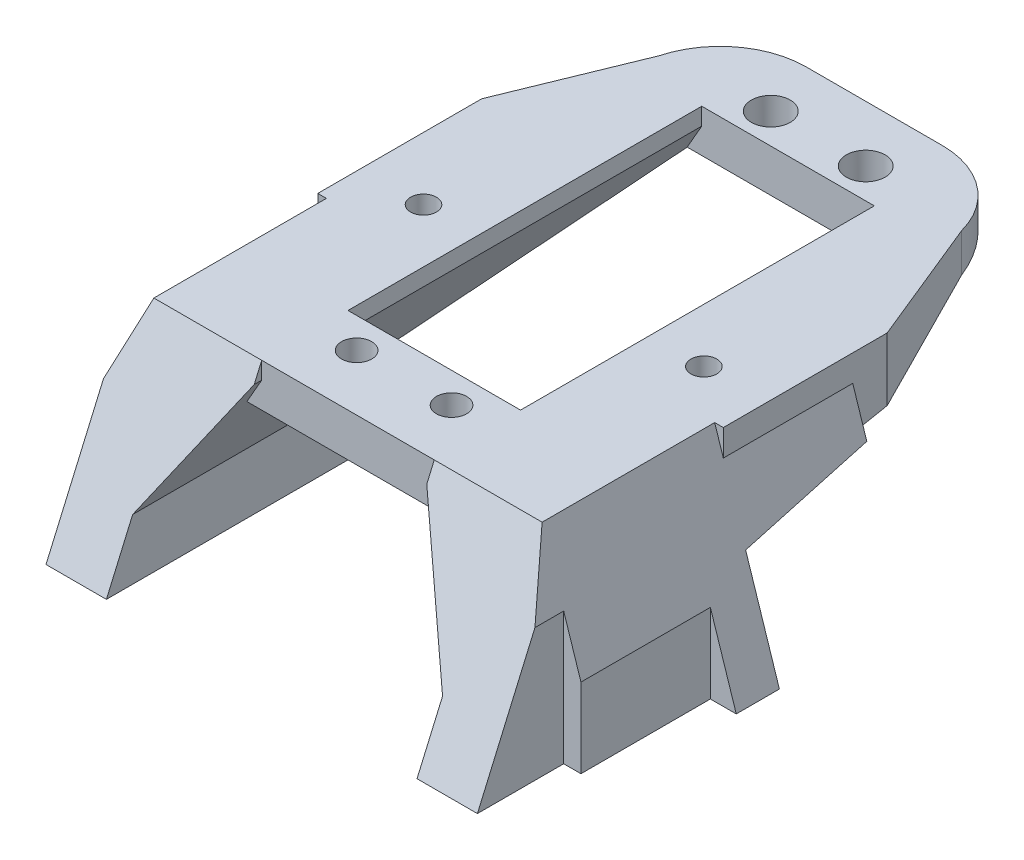
from build123d import *

# Parameters (mm, degrees)
SALIENTE_EXTRUIR1_DEPTH = 35
CROQUIS6_R              = 2.25
CROQUIS6_W              = 20
CROQUIS6_H              = 25
CORTAR_EXTRUIR3_DEPTH   = 10
CROQUIS7_R              = 2.25
SALIENTE_EXTRUIR4_DEPTH = 15
CROQUIS8_R              = 1.5
CORTAR_EXTRUIR4_DEPTH   = 10
CORTAR_EXTRUIR8_DEPTH   = 50
CORTAR_EXTRUIR11_REACH  = 69.158
CORTAR_EXTRUIR12_DEPTH  = 16
CROQUIS13_W             = 6.081292266
CROQUIS13_H             = 9.753773429
CORTAR_EXTRUIR13_DEPTH  = 15
CORTAR_EXTRUIR14_DEPTH  = 63.5
CORTAR_EXTRUIR15_DEPTH  = 100
SALIENTE_EXTRUIR5_REACH = 69.158
CROQUIS16_W             = 15
CROQUIS16_H             = 10
CORTAR_EXTRUIR16_DEPTH  = 200
CORTAR_EXTRUIR17_DEPTH  = 200
SALIENTE_EXTRUIR7_DEPTH = 23.5
CROQUIS22_R             = 2.25
CORTAR_EXTRUIR19_DEPTH  = 47
CORTAR_EXTRUIR20_DEPTH  = 31
CROQUIS24_W             = 29.420485752
CROQUIS24_H             = 5
SALIENTE_EXTRUIR9_DEPTH = 10
CROQUIS25_R             = 1.75
CROQUIS25_R_2           = 1.5
CORTAR_EXTRUIR21_DEPTH  = 5


with BuildPart() as part:
    # Croquis1 → Saliente-Extruir1 (new body)
    with BuildSketch(Plane.XY):
        Polygon((0, 0), (45, 0), (52.5, -23), (40.5, -23), (40.5, -16.192411456), (32.5, -2), (12.5, -2), (4.5, -16), (4.5, -23), (-7.5, -23), align=None)
    extrude(amount=SALIENTE_EXTRUIR1_DEPTH)

    # Croquis6 → Cortar-Extruir3 (cut)
    with BuildSketch(Plane(origin=(0, 0, 0), x_dir=(1, 0, 0), z_dir=(0, 1, 0))):
        with Locations(Location((17, -28.5, 0), (0, 0, 180))):
            Circle(CROQUIS6_R)
        with Locations(Location((28, -28.5, 0), (0, 0, 270))):
            Circle(CROQUIS6_R)
        with Locations((22.5, -12.5)):
            Rectangle(CROQUIS6_W, CROQUIS6_H)
    extrude(amount=-CORTAR_EXTRUIR3_DEPTH, mode=Mode.SUBTRACT)

    # Croquis8 → Cortar-Extruir4 (cut)
    with BuildSketch(Plane(origin=(0, -23, 0), x_dir=(-1, 0, 0), z_dir=(0, -1, 0))):
        with Locations(Location((-2.5, -33.3, 0), (0, 0, 90))):
            Circle(CROQUIS8_R)
        with Locations(Location((-42.5, -33.3, 0), (0, 0, 270))):
            Circle(CROQUIS8_R)
    extrude(amount=-CORTAR_EXTRUIR4_DEPTH, mode=Mode.SUBTRACT)

    # Cortar-Extruir11: up to this plane
    cortar_extruir11_end = Plane(origin=(50, -15, 0), z_dir=(0, -0.9079593845004518, -0.41905817746174695))
    # Croquis11 → Cortar-Extruir11 (cut, up to the surface)
    with BuildSketch(Plane.XZ.offset(23), mode=Mode.PRIVATE) as cortar_extruir11_sk1:
        with BuildLine():
            Line((-7.5, 15), (-7.5, -3.030649644))
            Line((-7.5, -3.030649644), (52.5, -3.030649644))
            Line((52.5, -3.030649644), (52.5, 15))
            ThreePointArc((52.5, 15), (22.5, 5.553378231), (-7.5, 15))
        make_face()
    cortar_extruir11_tool1 = split(extrude(cortar_extruir11_sk1.sketch, amount=-CORTAR_EXTRUIR11_REACH, mode=Mode.PRIVATE), bisect_by=cortar_extruir11_end, keep=Keep.BOTH, mode=Mode.PRIVATE)
    add(cortar_extruir11_tool1.solids().sort_by_distance((22.5, -23, 3.105508))[0], mode=Mode.SUBTRACT)

    # Croquis13 → Cortar-Extruir13 (cut)
    with BuildSketch(Plane.XY.offset(35)):
        with Locations((-7.540646133, -18.123113286)):
            Rectangle(CROQUIS13_W, CROQUIS13_H)
        with Locations((52.540646133, -18.123113286)):
            Rectangle(CROQUIS13_W, CROQUIS13_H)
    extrude(amount=-CORTAR_EXTRUIR13_DEPTH, mode=Mode.SUBTRACT)

    # Croquis14 → Cortar-Extruir14 (cut, symmetric)
    with BuildSketch(Plane(origin=(0, 0, 0), x_dir=(0, 0, -1), z_dir=(1, 0, 0))):
        Polygon((-15, -11), (-15, -28.858785619), (26, -23), (26, -3), align=None)
    extrude(amount=CORTAR_EXTRUIR14_DEPTH, both=True, mode=Mode.SUBTRACT)

    # Saliente-Extruir5: up to this face of the body (flat: up to its plane)
    saliente_extruir5_end = Plane(part.part.faces().sort_by_distance((6.25, 0, 0.570087713))[0])
    # Croquis16 → Saliente-Extruir5 (add, up to the picked face)
    with BuildSketch(Plane.XZ.offset(23), mode=Mode.PRIVATE) as saliente_extruir5_sk1:
        with Locations((5, 40)):
            Rectangle(CROQUIS16_W, CROQUIS16_H)
    saliente_extruir5_tool1 = split(extrude(saliente_extruir5_sk1.sketch, amount=-SALIENTE_EXTRUIR5_REACH, mode=Mode.PRIVATE), bisect_by=saliente_extruir5_end, keep=Keep.BOTH, mode=Mode.PRIVATE)
    # Croquis16 → Saliente-Extruir5 (add, up to the picked face)
    with BuildSketch(Plane.XZ.offset(23), mode=Mode.PRIVATE) as saliente_extruir5_sk2:
        with Locations((40, 40)):
            Rectangle(CROQUIS16_W, CROQUIS16_H)
    saliente_extruir5_tool2 = split(extrude(saliente_extruir5_sk2.sketch, amount=-SALIENTE_EXTRUIR5_REACH, mode=Mode.PRIVATE), bisect_by=saliente_extruir5_end, keep=Keep.BOTH, mode=Mode.PRIVATE)
    add(saliente_extruir5_tool1.solids().sort_by(Axis((5, -23, 40), (0, 1, 0)))[0])
    add(saliente_extruir5_tool2.solids().sort_by(Axis((40, -23, 40), (0, 1, 0)))[0])

    # Croquis17 → Cortar-Extruir16 (cut)
    with BuildSketch(Plane.ZY.offset(2.5)):
        Polygon((35, 0), (45, -23), (45, 0), align=None)
    extrude(amount=-CORTAR_EXTRUIR16_DEPTH, mode=Mode.SUBTRACT)

    # Croquis18 → Cortar-Extruir17 (cut)
    with BuildSketch(Plane(origin=(0, 0, 35), x_dir=(-1, 0, 0), z_dir=(0, 0, -1))):
        Polygon((-32.5, -2), (-40.5, -16.192411456), (-40.5, -23), (-32.5, -23), align=None)
        Polygon((-12.5, -23), (-4.5, -23), (-4.5, -16), (-12.5, -2), align=None)
        Polygon((-47.5, -7.666666667), (-45, 0), (-47.5, 0), align=None)
        Polygon((2.5, 0), (0, 0), (2.5, -7.666666667), align=None)
    extrude(amount=-CORTAR_EXTRUIR17_DEPTH, mode=Mode.SUBTRACT)



with BuildPart() as body_2:
    # Croquis7 → Saliente-Extruir4 (new body)
    with BuildSketch(Plane(origin=(0, 0, 0), x_dir=(1, 0, 0), z_dir=(0, 1, 0))):
        with BuildLine():
            Line((12.5, 16), (32.5, 16))
            Line((32.5, 16), (32.5, 0))
            Line((32.5, 0), (45, 0))
            Line((45, 0), (40.044296858, 18.577458823))
            ThreePointArc((40.044296858, 18.577458823), (36.474189304, 23.930150952), (30.382169451, 26))
            Line((30.382169451, 26), (14.617830549, 26))
            ThreePointArc((14.617830549, 26), (8.525810696, 23.930150952), (4.955703142, 18.577458823))
            Line((4.955703142, 18.577458823), (0, 0))
            Line((0, 0), (12.5, 0))
            Line((12.5, 0), (12.5, 16))
        make_face()
        with Locations((28, 19.5)):
            Circle(CROQUIS7_R, mode=Mode.SUBTRACT)
        with Locations((17, 19.5)):
            Circle(CROQUIS7_R, mode=Mode.SUBTRACT)
    extrude(amount=-SALIENTE_EXTRUIR4_DEPTH)

    # Croquis10 → Cortar-Extruir8 (cut)
    with BuildSketch(Plane(origin=(0, 0, 0), x_dir=(0, 0, -1), z_dir=(1, 0, 0))):
        Polygon((0, -15), (26, -3), (26, 0), (28.244981963, 0), (28.244981963, -21.856093693), align=None)
    extrude(amount=CORTAR_EXTRUIR8_DEPTH, mode=Mode.SUBTRACT)

    # Croquis12 → Cortar-Extruir12 (cut)
    with BuildSketch(Plane.XY):
        Polygon((12.5, -2), (12.5, -7.5), (12.5, -22.325980529), (0.885153984, -22.325980529), align=None)
        Polygon((44.114846016, -22.325980529), (32.5, -22.325980529), (32.5, -7.5), (32.5, -2), align=None)
    extrude(amount=-CORTAR_EXTRUIR12_DEPTH, mode=Mode.SUBTRACT)

    # Croquis15 → Cortar-Extruir15 (cut, symmetric)
    with BuildSketch(Plane(origin=(0, 0, 0), x_dir=(0, 0, -1), z_dir=(1, 0, 0))):
        Polygon((-15, -23), (-15, -11), (26, -3), align=None)
    extrude(amount=CORTAR_EXTRUIR15_DEPTH, both=True, mode=Mode.SUBTRACT)


with BuildPart() as part_1:
    add(part.part)

    add(body_2.part)  # Saliente-Extruir7 merges body 2
    # Croquis20 → Saliente-Extruir7 (add, symmetric)
    with BuildSketch(Plane(origin=(22.5, 0, 0), x_dir=(0, 0, -1), z_dir=(1, 0, 0))):
        Polygon((-15, -11), (-15, 0), (26, 0), (26, -3), align=None)
    extrude(amount=SALIENTE_EXTRUIR7_DEPTH, both=True)

    # Croquis22 → Cortar-Extruir19 (cut)
    with BuildSketch(Plane(origin=(0, 0, 0), x_dir=(1, 0, 0), z_dir=(0, 1, 0))):
        with Locations(Location((17, 19.5, 0), (0, 0, 180))):
            Circle(CROQUIS22_R)
        with Locations(Location((28, 19.5, 0), (0, 0, 180))):
            Circle(CROQUIS22_R)
        Polygon((12.5, 0), (12.5, -25), (32.5, -25), (32.5, 0), (32.5, 16), (12.5, 16), align=None)
        with BuildLine():
            Line((4.955703142, 18.577458823), (-2.632555673, 0))
            Line((-2.632555673, 0), (-11.688532454, 0))
            Line((-11.688532454, 0), (-11.688532454, 31.257495622))
            Line((-11.688532454, 31.257495622), (0, 31.257495622))
            Line((0, 31.257495622), (45, 31.257495622))
            Line((45, 31.257495622), (54.896993635, 31.257495622))
            Line((54.896993635, 31.257495622), (58.873924375, 0))
            Line((58.873924375, 0), (47.632555673, 0))
            Line((47.632555673, 0), (40.044296858, 18.577458823))
            ThreePointArc((40.044296858, 18.577458823), (36.474189304, 23.930150952), (30.382169451, 26))
            Line((30.382169451, 26), (14.617830549, 26))
            ThreePointArc((14.617830549, 26), (8.525810696, 23.930150952), (4.955703142, 18.577458823))
        make_face()
    extrude(amount=-CORTAR_EXTRUIR19_DEPTH, mode=Mode.SUBTRACT)

    # Croquis23 → Cortar-Extruir20 (cut)
    with BuildSketch(Plane.XY.offset(15)):
        Polygon((7.357142857, -11), (12.5, -11), (12.5, -2), align=None)
        Polygon((37.573133641, -11), (32.5, -2), (32.5, -11), align=None)
    extrude(amount=-CORTAR_EXTRUIR20_DEPTH, mode=Mode.SUBTRACT)

    # Croquis24 → Saliente-Extruir9 (add)
    with BuildSketch(Plane.XY.offset(35)):
        with Locations((22.884581513, -2.5)):
            Rectangle(CROQUIS24_W, CROQUIS24_H)
    extrude(amount=-SALIENTE_EXTRUIR9_DEPTH)

    # Croquis25 → Cortar-Extruir21 (cut)
    with BuildSketch(Plane(origin=(0, 0, 0), x_dir=(1, 0, 0), z_dir=(0, 1, 0))):
        with Locations(Location((17, -28.5, 0), (0, 0, 180))):
            Circle(CROQUIS25_R)
        with Locations((28, -28.5)):
            Circle(CROQUIS25_R)
        with Locations(Location((6.253029256, -10.000000184, 0), (0, 0, 180))):
            Circle(CROQUIS25_R_2)
        with Locations((38.746970744, -10.000000184)):
            Circle(CROQUIS25_R_2)
    extrude(amount=-CORTAR_EXTRUIR21_DEPTH, mode=Mode.SUBTRACT)


solid = part_1.part
